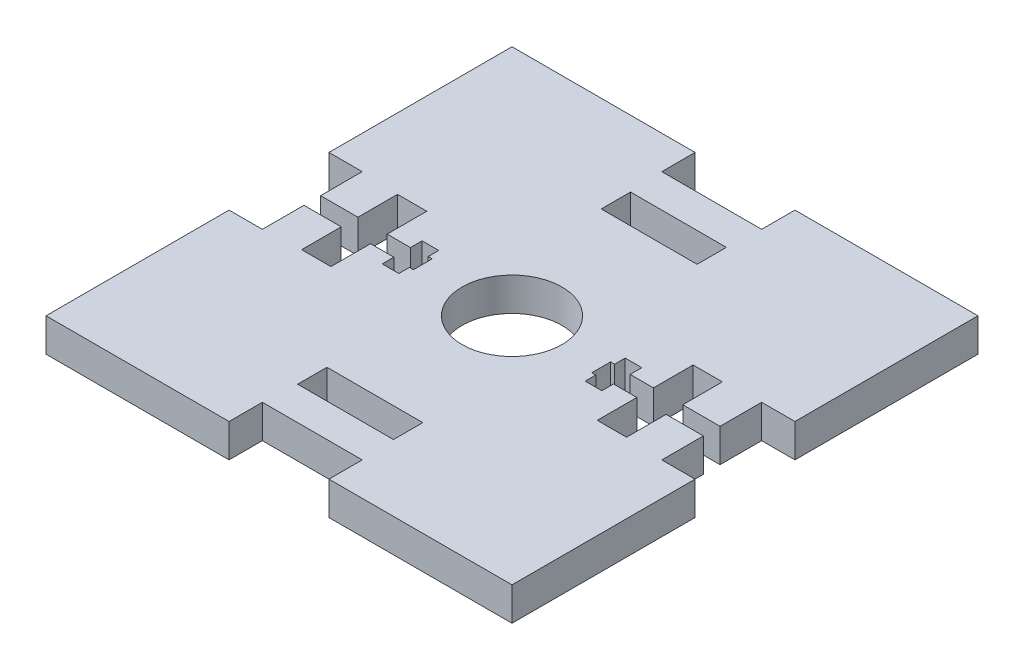
from build123d import *

# Parameters (mm, degrees)
SKETCH1_W           = 88.9
SKETCH1_H           = 88.9
BOSS_EXTRUDE1_DEPTH = 6.35
SKETCH2_R           = 9.525
SKETCH2_W           = 18.288
SKETCH2_H           = 5.588
SKETCH2_W_2         = 5.588
SKETCH2_H_2         = 18.288
CUT_EXTRUDE1_DEPTH  = 126.88384527
SKETCH3_W           = 19.05
SKETCH3_H           = 6.35
SKETCH3_W_2         = 6.35
SKETCH3_H_2         = 19.05
CUT_EXTRUDE2_DEPTH  = 126.88384527
CUT_EXTRUDE3_DEPTH  = 126.88384527


with BuildPart() as part:
    # Sketch1 → Boss-Extrude1 (new body)
    with BuildSketch(Plane(origin=(0, 0, 0), x_dir=(1, 0, 0), z_dir=(0, 1, 0))):
        with Locations((44.45, 44.45)):
            Rectangle(SKETCH1_W, SKETCH1_H)
    extrude(amount=BOSS_EXTRUDE1_DEPTH)

    # Sketch2 → Cut-Extrude1 (cut, through all)
    with BuildSketch(Plane(origin=(0, 6.35, 0), x_dir=(1, 0, 0), z_dir=(0, 1, 0))):
        with Locations(Location((44.45, 44.45, 0), (0, 0, 270))):
            Circle(SKETCH2_R)
        with Locations((44.45, 73.406)):
            Rectangle(SKETCH2_W, SKETCH2_H)
        with Locations((16.256, 44.45)):
            Rectangle(SKETCH2_W_2, SKETCH2_H_2)
        with Locations((72.644, 44.45)):
            Rectangle(SKETCH2_W_2, SKETCH2_H_2)
        with Locations((44.45, 15.494)):
            Rectangle(SKETCH2_W, SKETCH2_H)
    extrude(amount=-CUT_EXTRUDE1_DEPTH, mode=Mode.SUBTRACT)

    # Sketch3 → Cut-Extrude2 (cut, through all)
    with BuildSketch(Plane(origin=(0, 6.35, 0), x_dir=(1, 0, 0), z_dir=(0, 1, 0))):
        with Locations((44.45, 85.725)):
            Rectangle(SKETCH3_W, SKETCH3_H)
        with Locations((85.725, 44.45)):
            Rectangle(SKETCH3_W_2, SKETCH3_H_2)
        with Locations((44.45, 3.175)):
            Rectangle(SKETCH3_W, SKETCH3_H)
        with Locations((3.175, 44.45)):
            Rectangle(SKETCH3_W_2, SKETCH3_H_2)
    extrude(amount=-CUT_EXTRUDE2_DEPTH, mode=Mode.SUBTRACT)

    # Sketch4 → Cut-Extrude3 (cut, through all)
    with BuildSketch(Plane(origin=(0, 6.35, 0), x_dir=(1, 0, 0), z_dir=(0, 1, 0))):
        Polygon((23.495, 46.0375), (23.495, 48.26), (26.67, 48.26), (26.67, 46.249166667), (27.432, 46.249166667), (27.432, 42.650833333), (26.67, 42.650833333), (26.67, 40.64), (23.495, 40.64), (23.495, 42.8625), (6.35, 42.8625), (6.35, 46.0375), align=None)
        Polygon((62.23, 46.249166667), (61.468, 46.249166667), (61.468, 42.650833333), (62.23, 42.650833333), (62.23, 40.64), (65.405, 40.64), (65.405, 42.8625), (82.55, 42.8625), (82.55, 46.0375), (65.405, 46.0375), (65.405, 48.26), (62.23, 48.26), align=None)
    extrude(amount=-CUT_EXTRUDE3_DEPTH, mode=Mode.SUBTRACT)


solid = part.part
